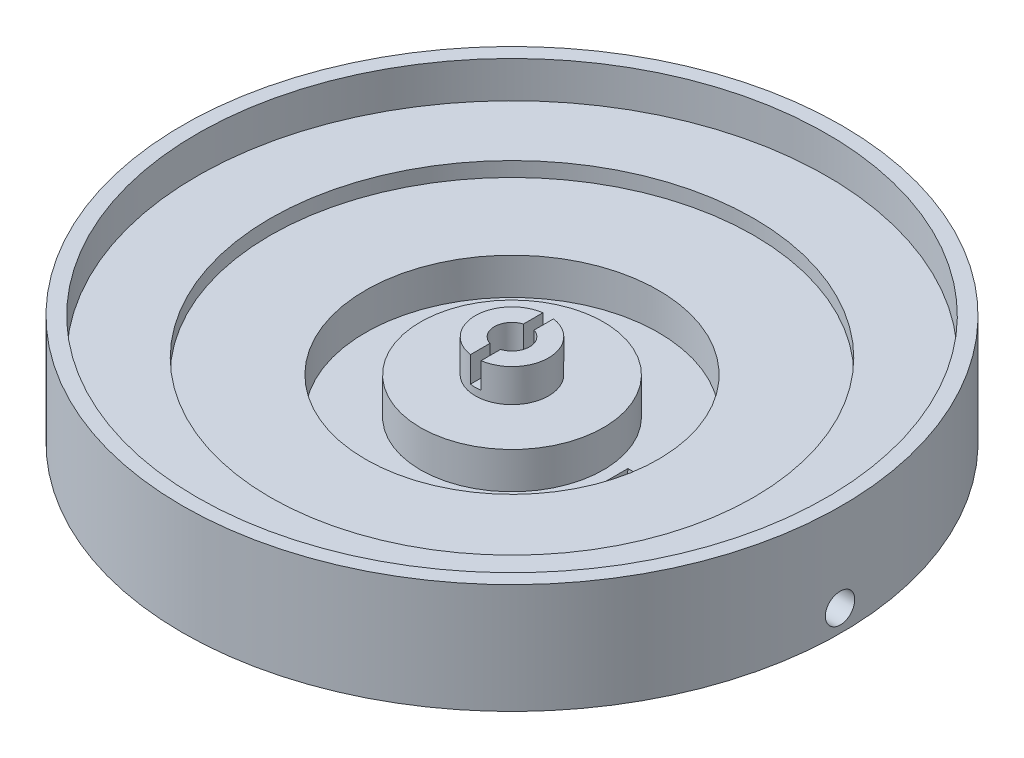
from build123d import *

# Parameters (mm, degrees)
SKETCH1_R               = 45
BOSS_EXTRUDE1_DEPTH     = 15
SHELL1_T                = -2
SKETCH11_R              = 43.514084806
BOSS_EXTRUDE4_DEPTH     = 8
SKETCH12_R              = 33
CUT_EXTRUDE2_DEPTH      = 2
SKETCH2_R               = 5
BOSS_EXTRUDE2_DEPTH     = 4.5
SKETCH16_W              = 1.444334904
SKETCH16_H              = 11.111163506
CUT_EXTRUDE3_DEPTH      = 3.5
SKETCH7_R               = 2.4
CUT_EXTRUDE1_DEPTH      = 3.5
SKETCH18_R              = 1.3
CUT_EXTRUDE4_DEPTH      = 17
SKETCH19_R              = 3.5
CUT_EXTRUDE5_DEPTH      = 8
CUT_EXTRUDE6_DEPTH      = 77.485292704
CUT_EXTRUDE6_DEPTH_BACK = 1
SKETCH20_R              = 2
SKETCH22_R              = 20
SKETCH22_R_2            = 12.5
CUT_EXTRUDE10_DEPTH     = 5
CUT_EXTRUDE11_DEPTH     = 6


with BuildPart() as part:
    # Sketch1 → Boss-Extrude1 (new body)
    with BuildSketch(Plane(origin=(0, 0, 0), x_dir=(1, 0, 0), z_dir=(0, 1, 0))):
        with Locations(Location((0, 0, 0), (0, 0, 270))):
            Circle(SKETCH1_R)
    extrude(amount=BOSS_EXTRUDE1_DEPTH)

    # Shell1
    shell1_openings = [part.faces().sort_by_distance(p)[0] for p in [
        (0, 15, 0),
    ]]
    offset(amount=SHELL1_T, openings=shell1_openings, kind=Kind.INTERSECTION)

    # Sketch11 → Boss-Extrude4 (add)
    with BuildSketch(Plane(origin=(0, 2, 0), x_dir=(1, 0, 0), z_dir=(0, 1, 0))):
        with Locations((0, 0.514084806)):
            Circle(SKETCH11_R)
    extrude(amount=BOSS_EXTRUDE4_DEPTH)

    # Sketch12 → Cut-Extrude2 (cut)
    with BuildSketch(Plane(origin=(0, 10, 0), x_dir=(1, 0, 0), z_dir=(0, 1, 0))):
        with Locations(Location((0, 0, 0), (0, 0, 270))):
            Circle(SKETCH12_R)
    extrude(amount=-CUT_EXTRUDE2_DEPTH, mode=Mode.SUBTRACT)

    # Sketch2 → Boss-Extrude2 (add)
    with BuildSketch(Plane(origin=(0, 8, 0), x_dir=(1, 0, 0), z_dir=(0, 1, 0))):
        with Locations(Location((0, 0, 0), (0, 0, 270))):
            Circle(SKETCH2_R)
    extrude(amount=BOSS_EXTRUDE2_DEPTH)

    # Sketch16 → Cut-Extrude3 (cut)
    with BuildSketch(Plane(origin=(0, 12.5, 0), x_dir=(1, 0, 0), z_dir=(0, 1, 0))):
        Rectangle(SKETCH16_W, SKETCH16_H)
    extrude(amount=-CUT_EXTRUDE3_DEPTH, mode=Mode.SUBTRACT)

    # Sketch7 → Cut-Extrude1 (cut)
    with BuildSketch(Plane(origin=(0, 12.5, 0), x_dir=(1, 0, 0), z_dir=(0, 1, 0))):
        Circle(SKETCH7_R)
    extrude(amount=-CUT_EXTRUDE1_DEPTH, mode=Mode.SUBTRACT)

    # Sketch18 → Cut-Extrude4 (cut)
    with BuildSketch(Plane.XZ):
        with Locations(Location((0, 0, 0), (0, 0, 270))):
            Circle(SKETCH18_R)
    extrude(amount=-CUT_EXTRUDE4_DEPTH, mode=Mode.SUBTRACT)

    # Sketch19 → Cut-Extrude5 (cut)
    with BuildSketch(Plane.XZ):
        with Locations(Location((0, 0, 0), (0, 0, 270))):
            Circle(SKETCH19_R)
    extrude(amount=-CUT_EXTRUDE5_DEPTH, mode=Mode.SUBTRACT)

    # Sketch20 → Cut-Extrude6 (cut, two sides: drawn at the far end of the back side and taken through both)
    with BuildSketch(Plane(origin=(15, 0, 0), x_dir=(0, 0, -1), z_dir=(1, 0, 0)).offset(-CUT_EXTRUDE6_DEPTH_BACK)):
        with Locations((-0.169435032, 3)):
            Circle(SKETCH20_R)
    extrude(amount=CUT_EXTRUDE6_DEPTH + CUT_EXTRUDE6_DEPTH_BACK, mode=Mode.SUBTRACT)

    # Sketch22 → Cut-Extrude10 (cut)
    with BuildSketch(Plane(origin=(0, 8, 0), x_dir=(1, 0, 0), z_dir=(0, 1, 0))):
        with Locations(Location((0, 0, 0), (0, 0, 270))):
            Circle(SKETCH22_R)
        with Locations(Location((0, 0, 0), (0, 0, 270))):
            Circle(SKETCH22_R_2, mode=Mode.SUBTRACT)
    extrude(amount=-CUT_EXTRUDE10_DEPTH, mode=Mode.SUBTRACT)

    # Sketch23 → Cut-Extrude11 (cut)
    with BuildSketch(Plane.XZ):
        Polygon((2.862741159, -5.945839979), (6.580619048, -0.493713422), (3.71787789, 5.452126557), (-2.862741159, 5.945839979), (-6.580619048, 0.493713422), (-3.71787789, -5.452126557), align=None)
    extrude(amount=-CUT_EXTRUDE11_DEPTH, mode=Mode.SUBTRACT)


solid = part.part
